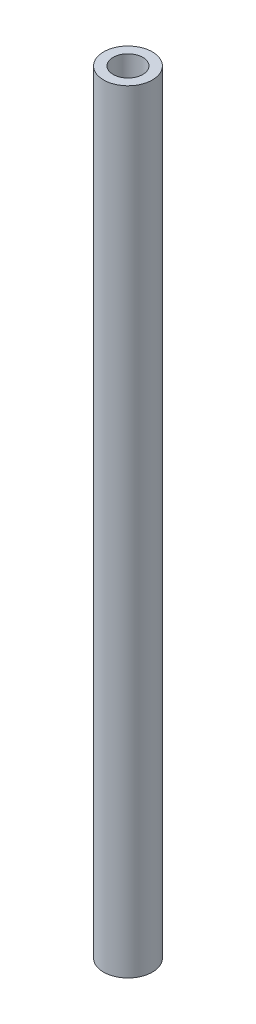
from build123d import *

# Parameters (mm, degrees)
SKETCH1_R           = 0.082
SKETCH1_R_2         = 0.05
BOSS_EXTRUDE1_DEPTH = 2.6


with BuildPart() as part:
    # Sketch1 → Boss-Extrude1 (new body)
    with BuildSketch(Plane(origin=(0, 0, 0), x_dir=(1, 0, 0), z_dir=(0, 1, 0))):
        with Locations(Location((0, 0, 0), (0, 0, 270))):
            Circle(SKETCH1_R)
        with Locations(Location((0, 0, 0), (0, 0, 270))):
            Circle(SKETCH1_R_2, mode=Mode.SUBTRACT)
    extrude(amount=BOSS_EXTRUDE1_DEPTH)


solid = part.part
